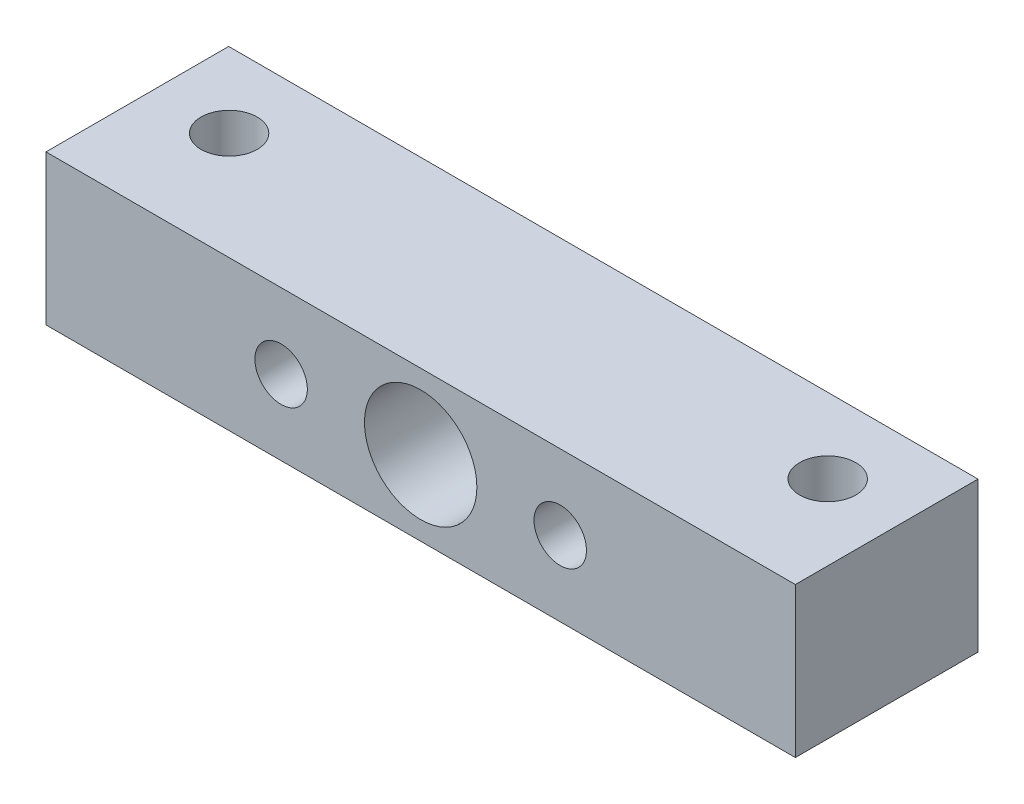
from build123d import *

# Parameters (mm, degrees)
SKETCH1_W           = 40
SKETCH1_H           = 9.75
SKETCH1_R           = 1.5
BOSS_EXTRUDE1_DEPTH = 8
CUT_EXTRUDE1_REACH  = 25.645
CUT_EXTRUDE2_REACH  = 25.645
SKETCH3_R           = 1.4


with BuildPart() as part:
    # Sketch1 → Boss-Extrude1 (new body)
    with BuildSketch(Plane(origin=(0, 0, 0), x_dir=(1, 0, 0), z_dir=(0, 1, 0))):
        Rectangle(SKETCH1_W, SKETCH1_H)
        with Locations(Location((-15.976056303, 0.875, 0), (0, 0, 270))):
            Circle(SKETCH1_R, mode=Mode.SUBTRACT)
        with Locations(Location((15.976056303, 0.875, 0), (0, 0, 90))):
            Circle(SKETCH1_R, mode=Mode.SUBTRACT)
    extrude(amount=BOSS_EXTRUDE1_DEPTH)

    # Sketch2 → Cut-Extrude1 (cut, up to next)
    with BuildSketch(Plane.XY.offset(4.875), mode=Mode.PRIVATE) as cut_extrude1_sk1:
        with BuildLine():
            ThreePointArc((3, 4), (2.121320344, 6.121320344), (0, 7))
            Line((0, 7), (0, 1))
            ThreePointArc((0, 1), (2.121320344, 1.878679656), (3, 4))
        make_face()
    cut_extrude1_tool1 = extrude(cut_extrude1_sk1.sketch, amount=-CUT_EXTRUDE1_REACH, mode=Mode.PRIVATE) & part.part
    # Sketch2 → Cut-Extrude1 (cut, up to next)
    with BuildSketch(Plane.XY.offset(4.875), mode=Mode.PRIVATE) as cut_extrude1_sk2:
        with BuildLine():
            Line((0, 1), (0, 7))
            ThreePointArc((0, 7), (-3, 4), (0, 1))
        make_face()
    cut_extrude1_tool2 = extrude(cut_extrude1_sk2.sketch, amount=-CUT_EXTRUDE1_REACH, mode=Mode.PRIVATE) & part.part
    # Sketch2 → Cut-Extrude1 (cut, up to next)
    with BuildSketch(Plane.XY.offset(4.875), mode=Mode.PRIVATE) as cut_extrude1_sk3:
        with BuildLine():
            ThreePointArc((3, 4), (2.121320344, 6.121320344), (0, 7))
            Line((0, 7), (0, 1))
            ThreePointArc((0, 1), (2.121320344, 1.878679656), (3, 4))
        make_face()
    cut_extrude1_tool3 = extrude(cut_extrude1_sk3.sketch, amount=-CUT_EXTRUDE1_REACH, mode=Mode.PRIVATE) & part.part
    # Sketch2 → Cut-Extrude1 (cut, up to next)
    with BuildSketch(Plane.XY.offset(4.875), mode=Mode.PRIVATE) as cut_extrude1_sk4:
        with BuildLine():
            Line((0, 1), (0, 7))
            ThreePointArc((0, 7), (-3, 4), (0, 1))
        make_face()
    cut_extrude1_tool4 = extrude(cut_extrude1_sk4.sketch, amount=-CUT_EXTRUDE1_REACH, mode=Mode.PRIVATE) & part.part
    add(cut_extrude1_tool1.solids().sort_by_distance((1.27324, 4, 4.875))[0], mode=Mode.SUBTRACT)
    add(cut_extrude1_tool2.solids().sort_by_distance((-1.27324, 4, 4.875))[0], mode=Mode.SUBTRACT)
    add(cut_extrude1_tool3.solids().sort_by_distance((1.27324, 4, 4.875))[0], mode=Mode.SUBTRACT)
    add(cut_extrude1_tool4.solids().sort_by_distance((-1.27324, 4, 4.875))[0], mode=Mode.SUBTRACT)

    # Sketch3 → Cut-Extrude2 (cut, up to next)
    with BuildSketch(Plane(origin=(0, 0, -4.875), x_dir=(-1, 0, 0), z_dir=(0, 0, -1)), mode=Mode.PRIVATE) as cut_extrude2_sk1:
        with Locations((7.45, 4)):
            Circle(SKETCH3_R)
    cut_extrude2_tool1 = extrude(cut_extrude2_sk1.sketch, amount=-CUT_EXTRUDE2_REACH, mode=Mode.PRIVATE) & part.part
    # Sketch3 → Cut-Extrude2 (cut, up to next)
    with BuildSketch(Plane(origin=(0, 0, -4.875), x_dir=(-1, 0, 0), z_dir=(0, 0, -1)), mode=Mode.PRIVATE) as cut_extrude2_sk2:
        with Locations((-7.45, 4)):
            Circle(SKETCH3_R)
    cut_extrude2_tool2 = extrude(cut_extrude2_sk2.sketch, amount=-CUT_EXTRUDE2_REACH, mode=Mode.PRIVATE) & part.part
    add(cut_extrude2_tool1.solids().sort_by_distance((-7.45, 4, -4.875))[0], mode=Mode.SUBTRACT)
    add(cut_extrude2_tool2.solids().sort_by_distance((7.45, 4, -4.875))[0], mode=Mode.SUBTRACT)


solid = part.part
